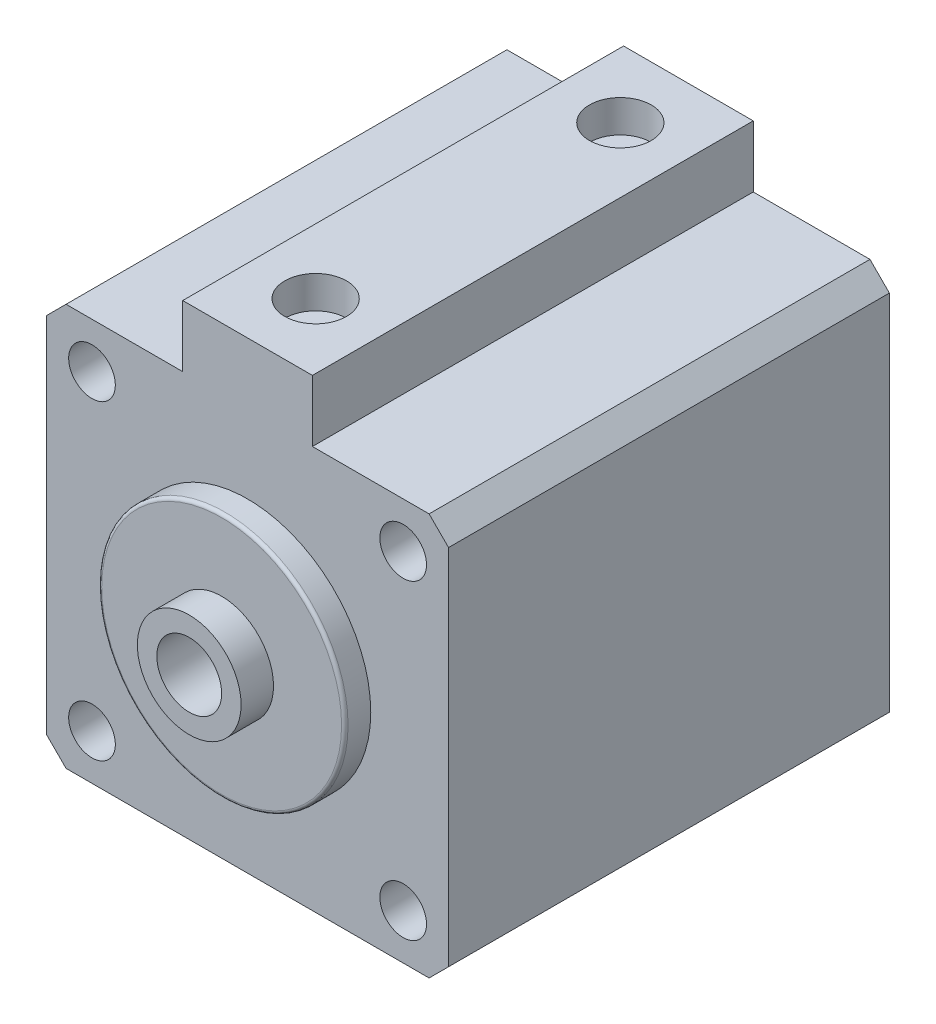
from build123d import *

# Parameters (mm, degrees)
ESQUISSE1_W                  = 62
ESQUISSE1_H                  = 62
BOSS_EXTRU_1_DEPTH           = 68
ESQUISSE2_R                  = 19
BOSS_EXTRU_2_DEPTH           = 4
ESQUISSE3_R                  = 8
BOSS_EXTRU_3_DEPTH           = 5
ENL_V_MAT_EXTRU_1_DEPTH      = 111.959452053
ENL_V_MAT_EXTRU_1_DEPTH_BACK = 111.959452053
ESQUISSE4_R                  = 3.6
CHANFREIN1_SIZE              = 3
ESQUISSE5_W                  = 20
ESQUISSE5_H                  = 9.5
BOSS_EXTRU_4_DEPTH           = 68
ESQUISSE6_R                  = 4.7625
ENL_V_MAT_EXTRU_2_DEPTH      = 5
ESQUISSE7_R                  = 5
ENL_V_MAT_EXTRU_3_DEPTH      = 70
CONG_1_R                     = 0.5


with BuildPart() as part:
    # Esquisse1 → Boss.-Extru.1 (new body)
    with BuildSketch(Plane.XY):
        with Locations((31, 31)):
            Rectangle(ESQUISSE1_W, ESQUISSE1_H)
    extrude(amount=BOSS_EXTRU_1_DEPTH)

    # Esquisse2 → Boss.-Extru.2 (add)
    with BuildSketch(Plane.XY.offset(68)):
        with Locations(Location((31, 31, 0), (0, 0, 180))):
            Circle(ESQUISSE2_R)
    extrude(amount=BOSS_EXTRU_2_DEPTH)

    # Esquisse3 → Boss.-Extru.3 (add)
    with BuildSketch(Plane.XY.offset(72)):
        with Locations((31, 31)):
            Circle(ESQUISSE3_R)
    extrude(amount=BOSS_EXTRU_3_DEPTH)

    # Esquisse4 → Enlèv. mat.-Extru.1 (cut, two sides: drawn at the far end of the back side and taken through both)
    with BuildSketch(Plane.XY.offset(68).offset(-ENL_V_MAT_EXTRU_1_DEPTH_BACK)):
        with Locations((7, 55)):
            Circle(ESQUISSE4_R)
        with Locations(Location((55, 55, 0), (0, 0, 180))):
            Circle(ESQUISSE4_R)
        with Locations((55, 7)):
            Circle(ESQUISSE4_R)
        with Locations(Location((7, 7, 0), (0, 0, 180))):
            Circle(ESQUISSE4_R)
    extrude(amount=ENL_V_MAT_EXTRU_1_DEPTH + ENL_V_MAT_EXTRU_1_DEPTH_BACK, mode=Mode.SUBTRACT)

    # Chanfrein1
    chanfrein1_edges = [part.edges().sort_by_distance(p)[0] for p in [
        (0, 62, 34),
        (62, 62, 34),
        (62, 0, 34),
        (0, 0, 34),
    ]]
    chamfer(chanfrein1_edges, length=CHANFREIN1_SIZE)

    # Esquisse5 → Boss.-Extru.4 (add)
    with BuildSketch(Plane.XY.offset(68)):
        with Locations((31, 66.75)):
            Rectangle(ESQUISSE5_W, ESQUISSE5_H)
    extrude(amount=-BOSS_EXTRU_4_DEPTH)

    # Esquisse6 → Enlèv. mat.-Extru.2 (cut)
    with BuildSketch(Plane(origin=(0, 71.5, 0), x_dir=(1, 0, 0), z_dir=(0, 1, 0))):
        with Locations(Location((31, -57.5, 0), (0, 0, 270))):
            Circle(ESQUISSE6_R)
        with Locations(Location((31, -10.5, 0), (0, 0, 90))):
            Circle(ESQUISSE6_R)
    extrude(amount=-ENL_V_MAT_EXTRU_2_DEPTH, mode=Mode.SUBTRACT)

    # Esquisse7 → Enlèv. mat.-Extru.3 (cut)
    with BuildSketch(Plane.XY.offset(77)):
        with Locations((31, 31)):
            Circle(ESQUISSE7_R)
    extrude(amount=-ENL_V_MAT_EXTRU_3_DEPTH, mode=Mode.SUBTRACT)

    # Congé1
    cong_1_edges = [part.edges().sort_by_distance(p)[0] for p in [
        (50, 31, 72),
    ]]
    fillet(cong_1_edges, radius=CONG_1_R)


solid = part.part
